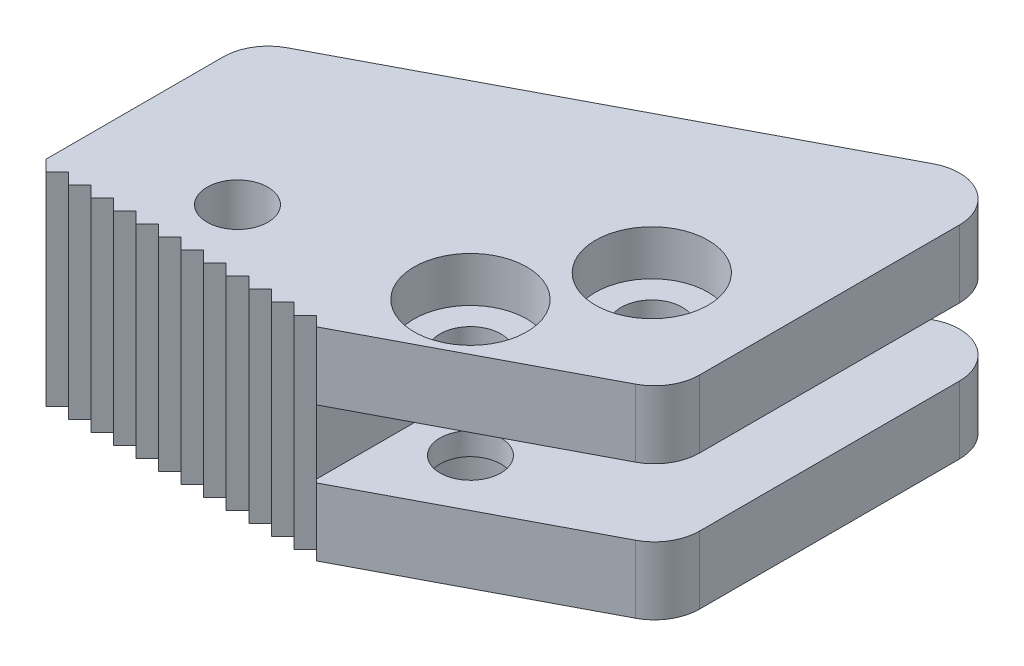
from build123d import *

# Parameters (mm, degrees)
BOSS_EXTRUDE1_DEPTH = 18
BOSS_EXTRUDE2_DEPTH = 18
SKETCH2_R           = 2.7
CUT_EXTRUDE1_DEPTH  = 60.970253183
SKETCH3_W           = 21
SKETCH3_H           = 6
CUT_EXTRUDE2_DEPTH  = 60.970253183
CUT_EXTRUDE5_DEPTH  = 60.970253183
SKETCH5_R           = 5
CUT_EXTRUDE4_DEPTH  = 4
FILLET1_R           = 4


with BuildPart() as part:
    # Sketch1 → Boss-Extrude1 (new body)
    with BuildSketch(Plane(origin=(0, 0, 0), x_dir=(1, 0, 0), z_dir=(0, 1, 0))):
        Polygon((37.602648402, 29.11), (37.602648402, 11), (16.67, 0), (0, 0), (0, 9.35), (0, 15.35), (37.602648402, 35.11), align=None)
    extrude(amount=BOSS_EXTRUDE1_DEPTH)

    # Sketch6 → Boss-Extrude2 (add, through all)
    with BuildSketch(Plane(origin=(0, 18, 0), x_dir=(1, 0, 0), z_dir=(0, 1, 0))):
        Polygon((0, 0), (-8, 0), (-8, 19.146040792), (37.602648402, 43.11), (37.602648402, 35.11), (0, 15.35), align=None)
    extrude(amount=-BOSS_EXTRUDE2_DEPTH)

    # Sketch2 → Cut-Extrude1 (cut, through all)
    with BuildSketch(Plane(origin=(0, 18, 0), x_dir=(1, 0, 0), z_dir=(0, 1, 0))):
        with Locations(Location((4, 6, 0), (0, 0, 270))):
            Circle(SKETCH2_R)
        with Locations(Location((21.62, 9.06, 0), (0, 0, 270))):
            Circle(SKETCH2_R)
        with Locations(Location((27.62, 19.16, 0), (0, 0, 270))):
            Circle(SKETCH2_R)
    extrude(amount=-CUT_EXTRUDE1_DEPTH, mode=Mode.SUBTRACT)

    # Sketch3 → Cut-Extrude2 (cut, through all)
    with BuildSketch(Plane.XY):
        with Locations((27.102648402, 9)):
            Rectangle(SKETCH3_W, SKETCH3_H)
    extrude(amount=-CUT_EXTRUDE2_DEPTH, mode=Mode.SUBTRACT)

    # Sketch4 → Cut-Extrude5 (cut, through all)
    with BuildSketch(Plane(origin=(0, 18, 0), x_dir=(1, 0, 0), z_dir=(0, 1, 0))):
        Polygon((-8, 0), (-8, 1), (-7, 0), (-6, 1), (-5, 0), (-4, 1), (-3, 0), (-2, 1), (-1, 0), (0, 1), (1, 0), (2, 1), (3, 0), (4, 1), (5, 0), (6, 1), (7, 0), (8, 1), (9, 0), (10, 1), (11, 0), (12, 1), (13, 0), (14, 1), (15, 0), (16, 1), (16.88632324, 0.11367676), (16.67, 0), (16.67, -0.2), (-8, -0.2), align=None)
    extrude(amount=-CUT_EXTRUDE5_DEPTH, mode=Mode.SUBTRACT)

    # Sketch5 → Cut-Extrude4 (cut)
    with BuildSketch(Plane.XZ):
        with Locations(Location((21.62, -9.06, 0), (0, 0, 270))):
            Circle(SKETCH5_R)
        with Locations(Location((27.62, -19.16, 0), (0, 0, 270))):
            Circle(SKETCH5_R)
    cut_extrude4 = extrude(amount=-CUT_EXTRUDE4_DEPTH, mode=Mode.SUBTRACT)

    # Mirror1: Cut-Extrude4 across plane
    add(cut_extrude4.mirror(Plane(origin=(0, 9, 0), x_dir=(0, 0, 1), z_dir=(0, -1, 0))), mode=Mode.SUBTRACT)

    # Fillet1
    fillet1_edges = [part.edges().sort_by_distance(p)[0] for p in [
        (37.602648402, 15, -11),
        (-8, 9, -19.146040792),
        (37.602648402, 3, -43.11),
        (37.602648402, 15, -43.11),
        (37.602648402, 3, -11),
    ]]
    fillet(fillet1_edges, radius=FILLET1_R)


solid = part.part
